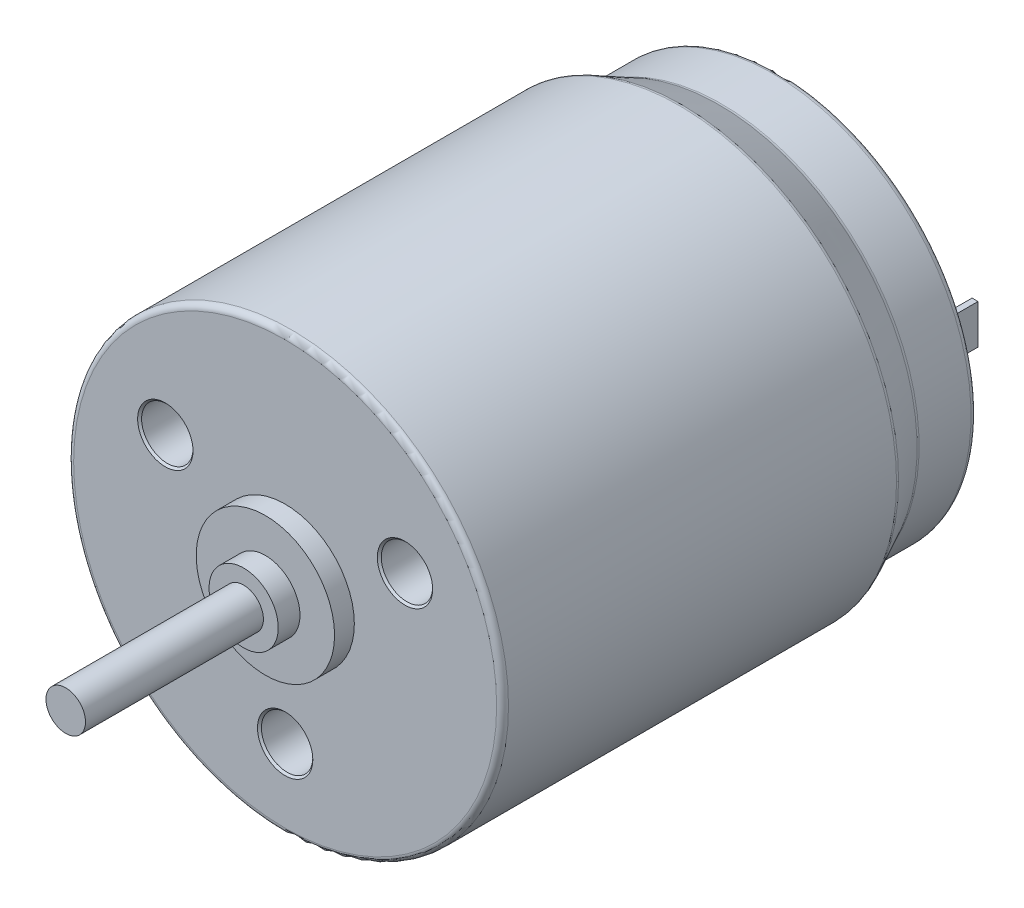
from build123d import *

# Parameters (mm, degrees)
SKETCH1_R           = 11
BOSS_EXTRUDE1_DEPTH = 20
SKETCH2_R           = 10
SKETCH3_R           = 10
BOSS_EXTRUDE2_DEPTH = 3
SKETCH4_R           = 1.3
CUT_EXTRUDE1_DEPTH  = 5
CHAMFER1_SIZE       = 0.1
SKETCH5_R           = 3.5
BOSS_EXTRUDE3_DEPTH = 1
SKETCH6_R           = 1.75
BOSS_EXTRUDE4_DEPTH = 1.1
SKETCH7_R           = 1
BOSS_EXTRUDE5_DEPTH = 9
SKETCH8_W           = 0.3
SKETCH8_H           = 2
BOSS_EXTRUDE6_DEPTH = 3.9
FILLET1_R           = 0.3


with BuildPart() as part:
    # Sketch1 → Boss-Extrude1 (new body)
    with BuildSketch(Plane.XY):
        Circle(SKETCH1_R)
    extrude(amount=-BOSS_EXTRUDE1_DEPTH)

    # Sketch2 → section 1 of loft1
    with BuildSketch(Plane(origin=(0, 0, -22), x_dir=(-1, 0, 0), z_dir=(0, 0, -1)), mode=Mode.PRIVATE) as loft1_s1:
        Circle(SKETCH2_R)
    # loft from a face of the part (loft1)
    loft([part.faces().sort_by_distance((0, 0, -20))[0], loft1_s1.sketch])

    # Sketch3 → Boss-Extrude2 (add)
    with BuildSketch(Plane(origin=(0, 0, -22), x_dir=(-1, 0, 0), z_dir=(0, 0, -1))):
        Circle(SKETCH3_R)
    extrude(amount=BOSS_EXTRUDE2_DEPTH)

    # Sketch4 → Cut-Extrude1 (cut)
    with BuildSketch(Plane.XY):
        with Locations((-6.062177826, 3.5)):
            Circle(SKETCH4_R)
        with Locations((6.062177826, 3.5)):
            Circle(SKETCH4_R)
        with Locations((0, -7)):
            Circle(SKETCH4_R)
    extrude(amount=-CUT_EXTRUDE1_DEPTH, mode=Mode.SUBTRACT)

    # Chamfer1
    chamfer1_edges = [part.edges().sort_by_distance(p)[0] for p in [
        (-7.362177826, 3.5, 0),
        (4.762177826, 3.5, 0),
        (-1.3, -7, 0),
    ]]
    chamfer(chamfer1_edges, length=CHAMFER1_SIZE)

    # Sketch5 → Boss-Extrude3 (add)
    with BuildSketch(Plane.XY):
        Circle(SKETCH5_R)
    extrude(amount=BOSS_EXTRUDE3_DEPTH)

    # Sketch6 → Boss-Extrude4 (add)
    with BuildSketch(Plane.XY.offset(1)):
        Circle(SKETCH6_R)
    extrude(amount=BOSS_EXTRUDE4_DEPTH)

    # Sketch7 → Boss-Extrude5 (add)
    with BuildSketch(Plane.XY.offset(2.1)):
        Circle(SKETCH7_R)
    extrude(amount=BOSS_EXTRUDE5_DEPTH)

    # Sketch8 → Boss-Extrude6 (add)
    with BuildSketch(Plane(origin=(0, 0, -25), x_dir=(-1, 0, 0), z_dir=(0, 0, -1))):
        with Locations((-6, 0)):
            Rectangle(SKETCH8_W, SKETCH8_H)
        with Locations((6, 0)):
            Rectangle(SKETCH8_W, SKETCH8_H)
    extrude(amount=BOSS_EXTRUDE6_DEPTH)

    # Fillet1
    fillet1_edges = [part.edges().sort_by_distance(p)[0] for p in [
        (10, 0, -25),
        (-11, 0, 0),
        (0, 10, -22),
        (-11, 0, -20),
    ]]
    fillet(fillet1_edges, radius=FILLET1_R)


solid = part.part
